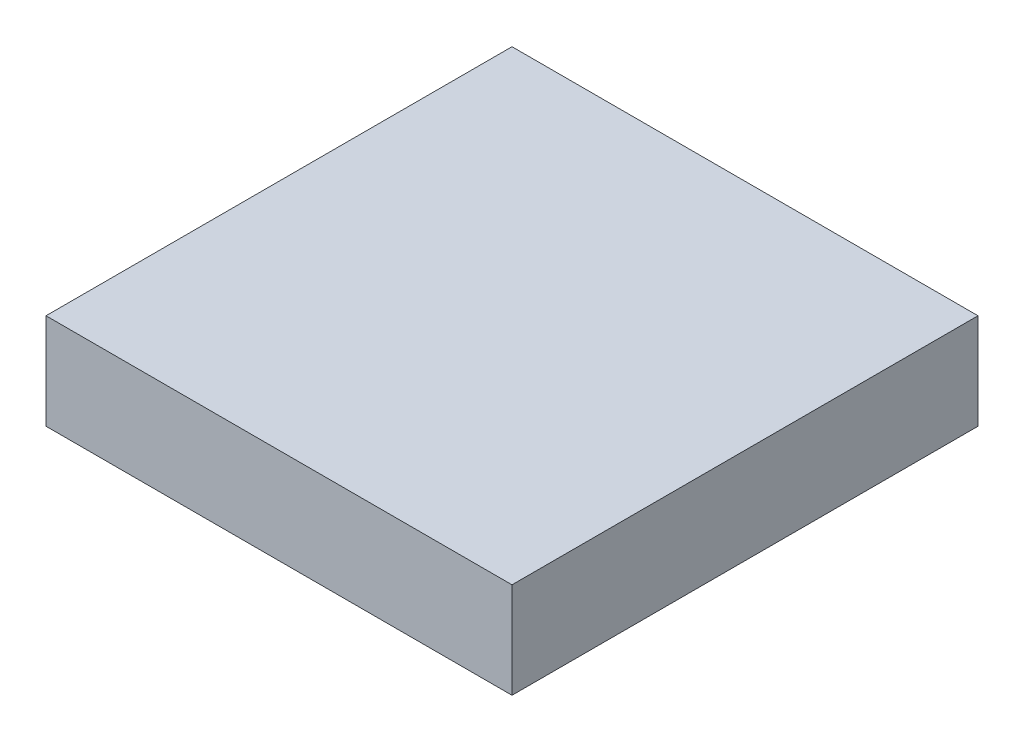
from build123d import *

# Parameters (mm, degrees)
SKETCH1_W           = 88.9
SKETCH1_H           = 88.9
BOSS_EXTRUDE1_DEPTH = 18.25625


with BuildPart() as part:
    # Sketch1 → Boss-Extrude1 (new body)
    with BuildSketch(Plane(origin=(0, 0, 0), x_dir=(1, 0, 0), z_dir=(0, 1, 0))):
        Rectangle(SKETCH1_W, SKETCH1_H)
    extrude(amount=BOSS_EXTRUDE1_DEPTH)


solid = part.part
